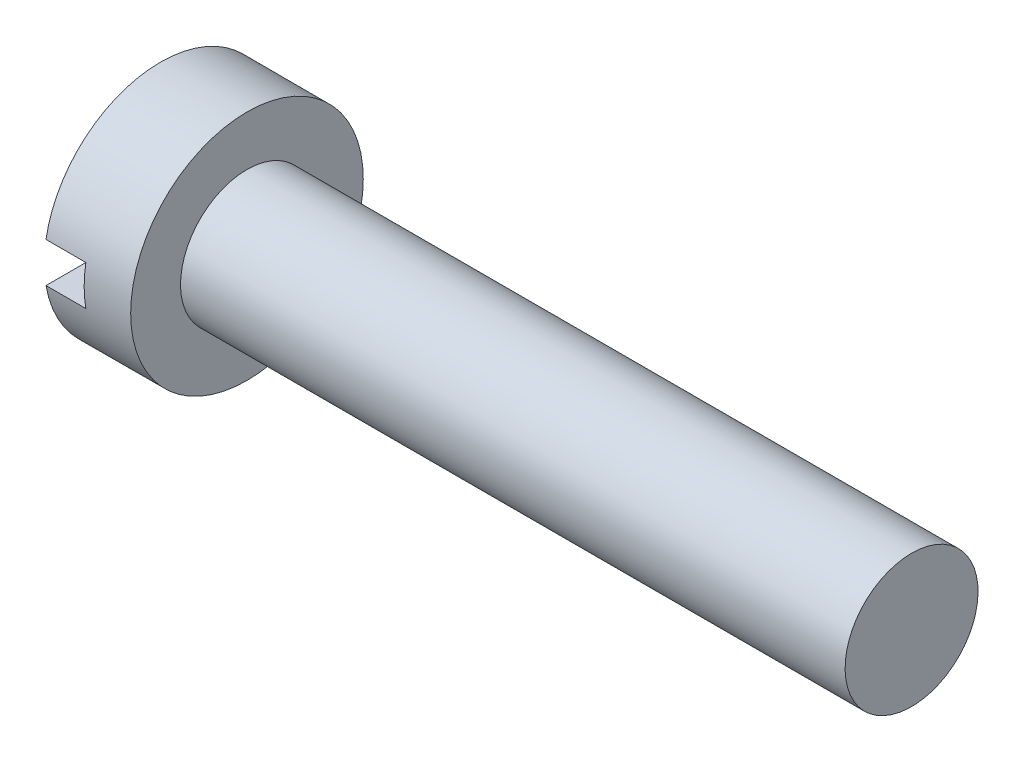
from build123d import *

# Parameters (mm, degrees)
SKETCH2_W          = 7
SKETCH2_H          = 1.2
CUT_EXTRUDE1_DEPTH = 1.2


with BuildPart() as part:
    # Sketch1 → Revolve1 (revolve)
    with BuildSketch(Plane.XY):
        Polygon((0, 0), (0, 3.5), (2.6, 3.5), (2.6, 2), (22.6, 2), (22.6, 0), align=None)
    revolve(axis=Axis((22.6, 0, 0), (-1, 0, 0)))

    # Sketch2 → Cut-Extrude1 (cut)
    with BuildSketch(Plane.ZY):
        Rectangle(SKETCH2_W, SKETCH2_H)
    extrude(amount=-CUT_EXTRUDE1_DEPTH, mode=Mode.SUBTRACT)


solid = part.part
